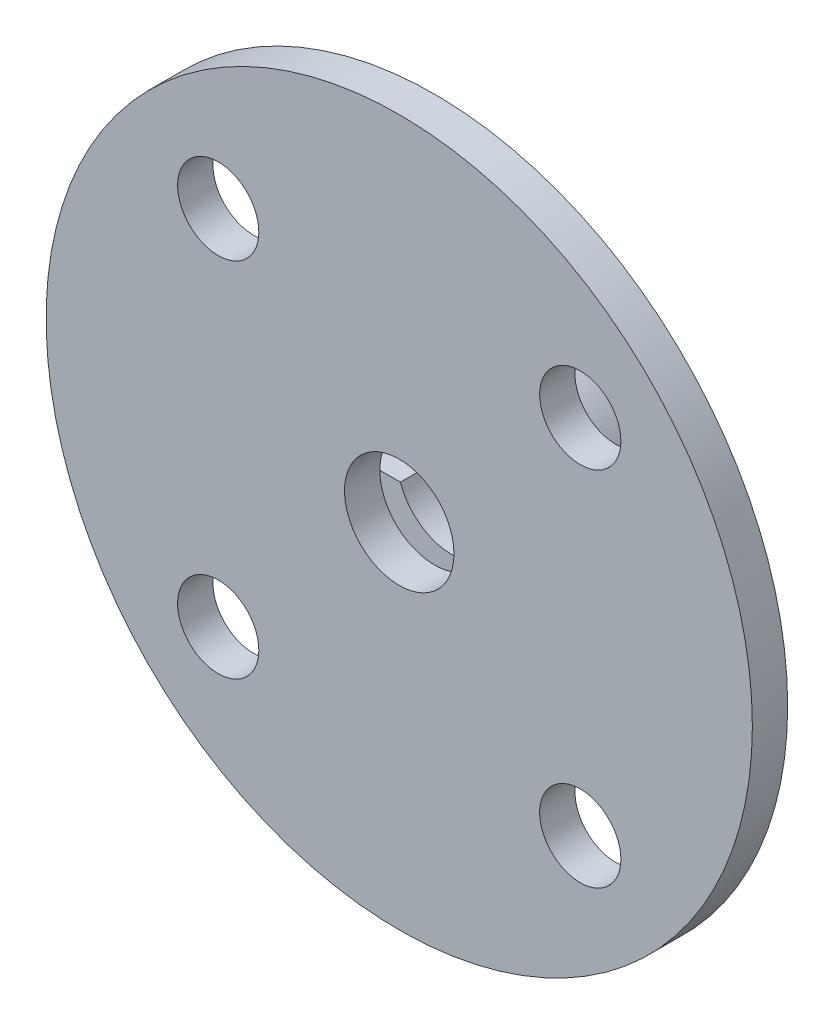
from build123d import *

# Parameters (mm, degrees)
SKETCH_1_R          = 14
SKETCH_1_R_2        = 1.5
EXTRUDE_1_DEPTH     = 2
CUT_EXTRUDE_1_DEPTH = 20.899748742
EXTRUDE_4_DEPTH     = 1
SKETCH_6_R          = 7
SKETCH_6_R_2        = 3.1
EXTRUDE_5_DEPTH     = 5
EXTRUDE_6_DEPTH     = 1
SKETCH_8_W          = 8
SKETCH_8_H          = 2
EXTRUDE_7_DEPTH     = 5
SKETCH_9_R          = 1.6
CUT_EXTRUDE_3_DEPTH = 24.108440017
EXTRUDE_8_DEPTH     = 2
SKETCH_11_W         = 12.041493288
SKETCH_11_H         = 2
CUT_EXTRUDE_4_DEPTH = 5
SKETCH_12_R         = 20
SKETCH_12_R_2       = 3.1
EXTRUDE_9_DEPTH     = 2
SKETCH_13_R         = 2.3
CUT_EXTRUDE_5_DEPTH = 2
CUT_EXTRUDE_START   = -1
CUT_EXTRUDE_6_DEPTH = 1
FILLET_1_R          = 3
FILLET_2_R          = 1.5


with BuildPart() as part:
    # 草图1 → 凸台-拉伸1 (new body)
    with BuildSketch(Plane.XY):
        Circle(SKETCH_1_R)
        with Locations((-7.071067812, 7.071067812)):
            Circle(SKETCH_1_R_2, mode=Mode.SUBTRACT)
        with Locations((7.071067812, 7.071067812)):
            Circle(SKETCH_1_R_2, mode=Mode.SUBTRACT)
        with Locations((-7.071067812, -7.071067812)):
            Circle(SKETCH_1_R_2, mode=Mode.SUBTRACT)
        with Locations((7.071067812, -7.071067812)):
            Circle(SKETCH_1_R_2, mode=Mode.SUBTRACT)
    extrude(amount=EXTRUDE_1_DEPTH)

    # 草图2 → 切除-拉伸1 (cut, through all)
    with BuildSketch(Plane(origin=(0, 0, 0), x_dir=(-1, 0, 0), z_dir=(0, 0, -1))):
        with BuildLine():
            ThreePointArc((-2.683281573, 3.1), (-4.1, 0), (-2.683281573, -3.1))
            Line((-2.683281573, -3.1), (2.683281573, -3.1))
            ThreePointArc((2.683281573, -3.1), (4.1, 0), (2.683281573, 3.1))
            Line((2.683281573, 3.1), (-2.683281573, 3.1))
        make_face()
    extrude(amount=-CUT_EXTRUDE_1_DEPTH, mode=Mode.SUBTRACT)

    # 草图3 → 凸台-拉伸4 (add)
    with BuildSketch(Plane(origin=(0, 0, 0), x_dir=(-1, 0, 0), z_dir=(0, 0, -1))):
        Polygon((0, 3.1), (3.7, 3.1), (3.7, 7.1), (-3.7, 7.1), (-3.7, 3.1), align=None)
    extrude(amount=EXTRUDE_4_DEPTH)

    # 草图6 → 凸台-拉伸5 (add)
    with BuildSketch(Plane(origin=(0, 0, -1), x_dir=(-1, 0, 0), z_dir=(0, 0, -1))):
        with Locations(Location((0, 0, 0), (0, 0, 121.908982735))):
            Circle(SKETCH_6_R)
        with Locations(Location((0, 0, 0), (0, 0, 90))):
            Circle(SKETCH_6_R_2, mode=Mode.SUBTRACT)
    extrude(amount=EXTRUDE_5_DEPTH)

    # 草图7 → 凸台-拉伸6 (add)
    with BuildSketch(Plane(origin=(0, 0, -6), x_dir=(-1, 0, 0), z_dir=(0, 0, -1))):
        with BuildLine():
            Line((-2.5, 3.1), (-2.5, 6.538348415))
            ThreePointArc((-2.5, 6.538348415), (0, 7), (2.5, 6.538348415))
            Line((2.5, 6.538348415), (2.5, 3.1))
            Line((2.5, 3.1), (-2.5, 3.1))
        make_face()
    extrude(amount=EXTRUDE_6_DEPTH)

    # 草图8 → 凸台-拉伸7 (add)
    with BuildSketch(Plane(origin=(0, 0, -6), x_dir=(-1, 0, 0), z_dir=(0, 0, -1))):
        with Locations((9.447401339, 2)):
            Rectangle(SKETCH_8_W, SKETCH_8_H)
        with Locations((9.447401339, -2)):
            Rectangle(SKETCH_8_W, SKETCH_8_H)
    extrude(amount=-EXTRUDE_7_DEPTH)

    # 草图9 → 切除-拉伸3 (cut, through all)
    with BuildSketch(Plane(origin=(0, 3, 0), x_dir=(1, 0, 0), z_dir=(0, 1, 0))):
        with Locations(Location((-10.8, 4, 0), (0, 0, 180))):
            Circle(SKETCH_9_R)
    extrude(amount=-CUT_EXTRUDE_3_DEPTH, mode=Mode.SUBTRACT)

    # 草图10 → 凸台-拉伸8 (add)
    with BuildSketch(Plane(origin=(0, 0, -7), x_dir=(-1, 0, 0), z_dir=(0, 0, -1))):
        with BuildLine():
            Line((-2.5, 6.538348415), (-2.5, 3.1))
            ThreePointArc((-2.5, 3.1), (0, -3.98246155), (2.5, 3.1))
            Line((2.5, 3.1), (2.5, 6.538348415))
            ThreePointArc((2.5, 6.538348415), (0, 7), (-2.5, 6.538348415))
        make_face()
    extrude(amount=EXTRUDE_8_DEPTH)

    # 草图11 → 切除-拉伸4 (cut)
    with BuildSketch(Plane(origin=(0, 0, -6), x_dir=(-1, 0, 0), z_dir=(0, 0, -1))):
        with Locations((7.426654695, 0)):
            Rectangle(SKETCH_11_W, SKETCH_11_H)
    extrude(amount=-CUT_EXTRUDE_4_DEPTH, mode=Mode.SUBTRACT)

    # 草图12 → 凸台-拉伸9 (add)
    with BuildSketch(Plane.XY.offset(2)):
        Circle(SKETCH_12_R)
        Circle(SKETCH_12_R_2, mode=Mode.SUBTRACT)
    extrude(amount=-EXTRUDE_9_DEPTH)

    # 草图13 → 切除-拉伸5 (cut)
    with BuildSketch(Plane.XY.offset(2)):
        with Locations((10.253048327, 10.253048327)):
            Circle(SKETCH_13_R)
        with Locations((-10.253048327, 10.253048327)):
            Circle(SKETCH_13_R)
        with Locations((-10.253048327, -10.253048327)):
            Circle(SKETCH_13_R)
        with Locations((10.253048327, -10.253048327)):
            Circle(SKETCH_13_R)
    extrude(amount=-CUT_EXTRUDE_5_DEPTH, mode=Mode.SUBTRACT)

    # 草图14 → 切除-拉伸6 (cut)
    with BuildSketch(Plane(origin=(0, 0, -1), x_dir=(-1, 0, 0), z_dir=(0, 0, -1)).offset(CUT_EXTRUDE_START)):
        with BuildLine():
            Line((-4.590882623, 5.284297185), (-4.590882623, 9.738638689))
            Line((-4.590882623, 9.738638689), (4.724825977, 9.738638689))
            Line((4.724825977, 9.738638689), (4.724825977, 5.164883298))
            ThreePointArc((4.724825977, 5.164883298), (0.089722487, 6.999424967), (-4.590882623, 5.284297185))
        make_face()
    extrude(amount=CUT_EXTRUDE_6_DEPTH, mode=Mode.SUBTRACT)

    # 圆角1
    fillet_1_edges = [part.edges().sort_by_distance(p)[0] for p in [
        (0, 7, -9),
    ]]
    fillet(fillet_1_edges, radius=FILLET_1_R)

    # 圆角2
    fillet_2_edges = [part.edges().sort_by_distance(p)[0] for p in [
        (-13.447401339, -2, -1),
        (-13.447401339, -2, -6),
        (-13.447401339, 2, -1),
        (-13.447401339, 2, -6),
    ]]
    fillet(fillet_2_edges, radius=FILLET_2_R)


solid = part.part
